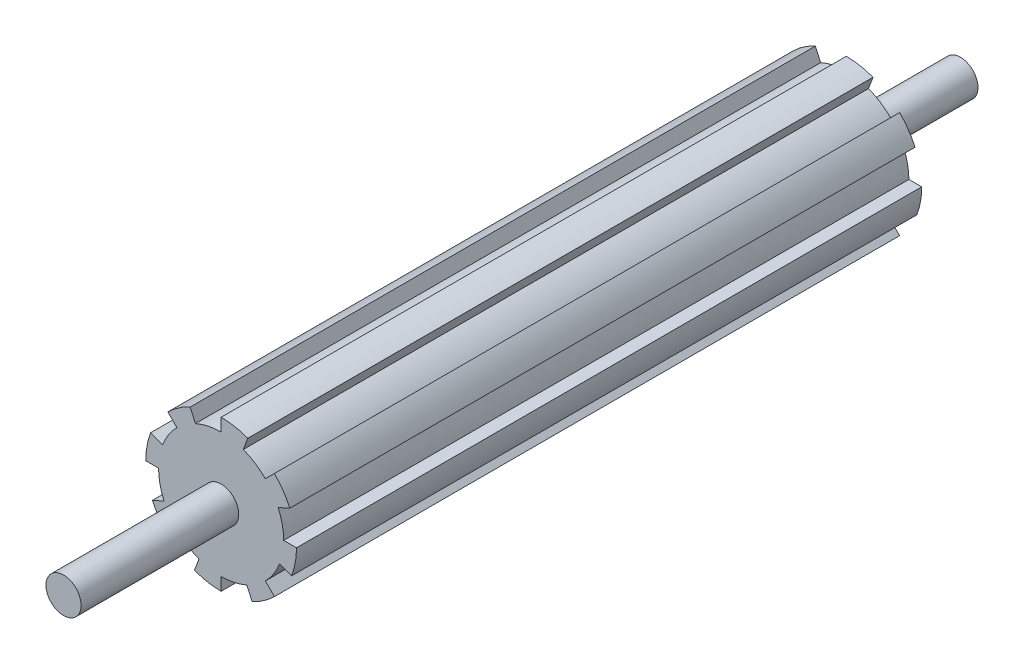
from build123d import *

# Parameters (mm, degrees)
BOSS_EXTRUDE1_DEPTH = 35.585942761
SKETCH2_R           = 1
BOSS_EXTRUDE2_DEPTH = 8.970038879
BOSS_EXTRUDE3_START = 6.494237864
SKETCH3_R           = 1
BOSS_EXTRUDE3_DEPTH = 6.494237864


with BuildPart() as part:
    # Sketch1 → Boss-Extrude1 (new body)
    with BuildSketch(Plane.XY):
        with BuildLine():
            Line((0, 3.560392335), (0, 4.291474396))
            ThreePointArc((0, 4.291474396), (0.77248629, 4.221376248), (1.519736563, 4.013371808))
            Line((1.519736563, 4.013371808), (1.260839029, 3.329666428))
            ThreePointArc((1.260839029, 3.329666428), (1.932350917, 2.990386849), (2.517577564, 2.517577564))
            Line((2.517577564, 2.517577564), (3.034530647, 3.034530647))
            ThreePointArc((3.034530647, 3.034530647), (3.531194065, 2.438733477), (3.912498451, 1.763266392))
            Line((3.912498451, 1.763266392), (3.245977537, 1.462881883))
            ThreePointArc((3.245977537, 1.462881883), (3.480901257, 0.748144382), (3.560392335, 0))
            Line((3.560392335, 0), (4.291474396, 0))
            ThreePointArc((4.291474396, 0), (4.221376248, -0.77248629), (4.013371808, -1.519736563))
            Line((4.013371808, -1.519736563), (3.329666428, -1.260839029))
            ThreePointArc((3.329666428, -1.260839029), (2.990386849, -1.932350917), (2.517577564, -2.517577564))
            Line((2.517577564, -2.517577564), (3.034530647, -3.034530647))
            ThreePointArc((3.034530647, -3.034530647), (2.438733477, -3.531194065), (1.763266392, -3.912498451))
            Line((1.763266392, -3.912498451), (1.462881883, -3.245977537))
            ThreePointArc((1.462881883, -3.245977537), (0.748144382, -3.480901257), (0, -3.560392335))
            Line((0, -3.560392335), (0, -4.291474396))
            ThreePointArc((0, -4.291474396), (-0.77248629, -4.221376248), (-1.519736563, -4.013371808))
            Line((-1.519736563, -4.013371808), (-1.260839029, -3.329666428))
            ThreePointArc((-1.260839029, -3.329666428), (-1.932350917, -2.990386849), (-2.517577564, -2.517577564))
            Line((-2.517577564, -2.517577564), (-3.034530647, -3.034530647))
            ThreePointArc((-3.034530647, -3.034530647), (-3.531194065, -2.438733477), (-3.912498451, -1.763266392))
            Line((-3.912498451, -1.763266392), (-3.245977537, -1.462881883))
            ThreePointArc((-3.245977537, -1.462881883), (-3.480901257, -0.748144382), (-3.560392335, 0))
            Line((-3.560392335, 0), (-4.291474396, 0))
            ThreePointArc((-4.291474396, 0), (-4.221376248, 0.77248629), (-4.013371808, 1.519736563))
            Line((-4.013371808, 1.519736563), (-3.329666428, 1.260839029))
            ThreePointArc((-3.329666428, 1.260839029), (-2.990386849, 1.932350917), (-2.517577564, 2.517577564))
            Line((-2.517577564, 2.517577564), (-3.034530647, 3.034530647))
            ThreePointArc((-3.034530647, 3.034530647), (-2.438733477, 3.531194065), (-1.763266392, 3.912498451))
            Line((-1.763266392, 3.912498451), (-1.462881883, 3.245977537))
            ThreePointArc((-1.462881883, 3.245977537), (-0.748144382, 3.480901257), (0, 3.560392335))
        make_face()
    extrude(amount=BOSS_EXTRUDE1_DEPTH)

    # Sketch2 → Boss-Extrude2 (add)
    with BuildSketch(Plane.XY.offset(35.585942761)):
        Circle(SKETCH2_R)
    extrude(amount=BOSS_EXTRUDE2_DEPTH)

    # Sketch3 → Boss-Extrude3 (add)
    with BuildSketch(Plane(origin=(0, 0, 0), x_dir=(-1, 0, 0), z_dir=(0, 0, -1)).offset(BOSS_EXTRUDE3_START)):
        Circle(SKETCH3_R)
    extrude(amount=-BOSS_EXTRUDE3_DEPTH)


solid = part.part
